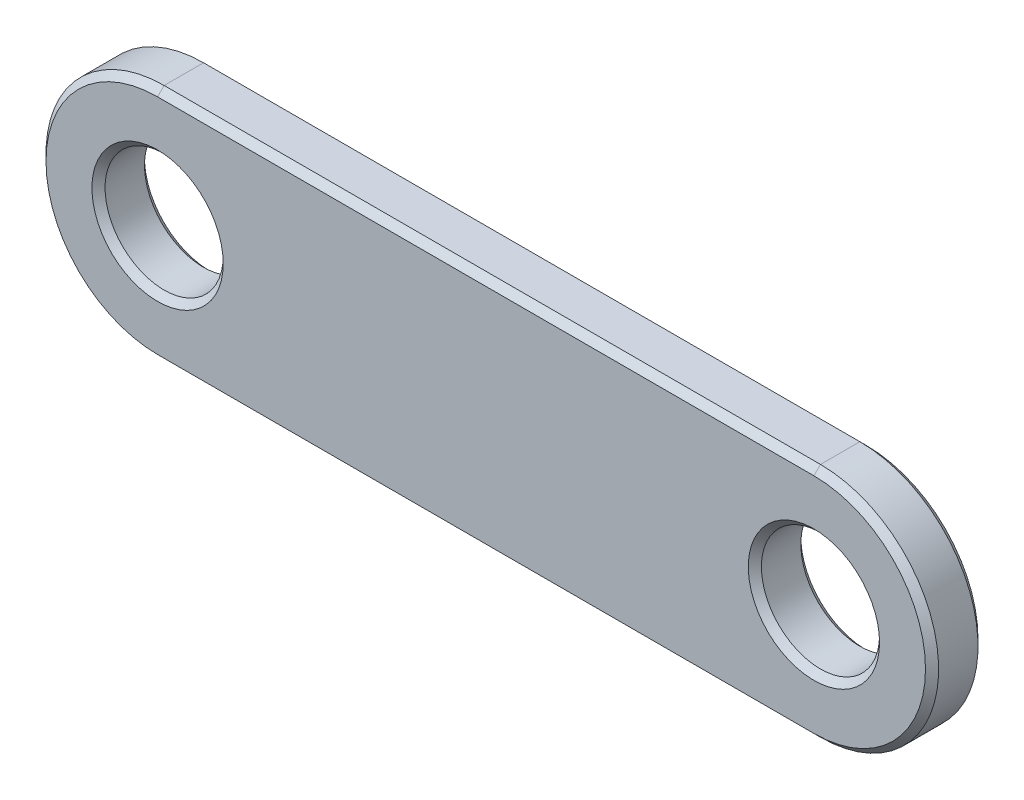
from build123d import *

# Parameters (mm, degrees)
SKETCH1_R           = 5.715
BOSS_EXTRUDE1_DEPTH = 5.08
CHAMFER1_SIZE       = 0.635


with BuildPart() as part:
    # Sketch1 → Boss-Extrude1 (new body)
    with BuildSketch(Plane.XY):
        with BuildLine():
            Line((-63.5, 11.43), (0, 11.43))
            ThreePointArc((0, 11.43), (11.43, 0), (0, -11.43))
            Line((0, -11.43), (-63.5, -11.43))
            ThreePointArc((-63.5, -11.43), (-74.93, 0), (-63.5, 11.43))
        make_face()
        Circle(SKETCH1_R, mode=Mode.SUBTRACT)
        with Locations((-63.5, 0)):
            Circle(SKETCH1_R, mode=Mode.SUBTRACT)
    extrude(amount=BOSS_EXTRUDE1_DEPTH)

    # Chamfer1
    chamfer1_edges = [part.edges().sort_by_distance(p)[0] for p in [
        (-5.715, 0, 0),
        (-5.715, 0, 5.08),
        (11.43, 0, 5.08),
        (-69.215, 0, 0),
        (-69.215, 0, 5.08),
        (-31.75, 11.43, 5.08),
        (-74.93, 0, 5.08),
        (-31.75, 11.43, 0),
        (11.43, 0, 0),
        (-31.75, -11.43, 0),
        (-74.93, 0, 0),
        (-31.75, -11.43, 5.08),
    ]]
    chamfer(chamfer1_edges, length=CHAMFER1_SIZE)


solid = part.part
